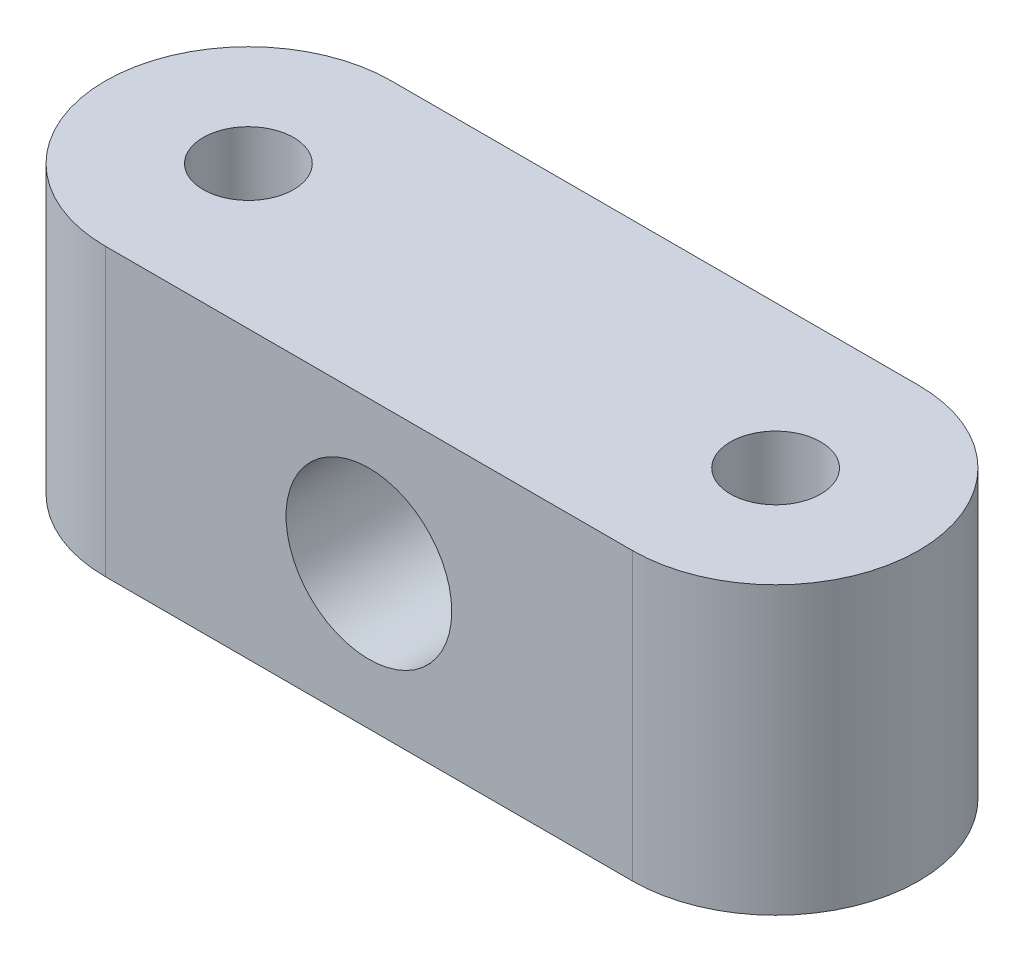
from build123d import *

# Parameters (mm, degrees)
SKETCH2_R                  = 6
BOSS_EXTRUDE1_DEPTH        = 38
M24X2_0_TAPPED_HOLE1_D     = 22
M24X2_0_TAPPED_HOLE1_DEPTH = 38
M24X2_0_TAPPED_HOLE1_TIP   = 6.609466809


with BuildPart() as part:
    # Sketch2 → Boss-Extrude1 (new body)
    with BuildSketch(Plane(origin=(0, 0, 0), x_dir=(1, 0, 0), z_dir=(0, 1, 0))):
        with BuildLine():
            Line((-35, 19), (35, 19))
            ThreePointArc((35, 19), (54, 0), (35, -19))
            Line((35, -19), (-35, -19))
            ThreePointArc((-35, -19), (-54, 0), (-35, 19))
        make_face()
        with Locations(Location((-35, 0, 0), (0, 0, 270))):
            Circle(SKETCH2_R, mode=Mode.SUBTRACT)
        with Locations(Location((35, 0, 0), (0, 0, 90))):
            Circle(SKETCH2_R, mode=Mode.SUBTRACT)
    extrude(amount=BOSS_EXTRUDE1_DEPTH)

    # M24x2.0 Tapped Hole1
    with Locations(Plane.XY.offset(19)):
        with Locations((0, 19)):
            Hole(M24X2_0_TAPPED_HOLE1_D / 2, depth=M24X2_0_TAPPED_HOLE1_DEPTH)
            with Locations((0, 0, -(M24X2_0_TAPPED_HOLE1_DEPTH + M24X2_0_TAPPED_HOLE1_TIP / 2))):  # 118° drill point
                Cone(0, M24X2_0_TAPPED_HOLE1_D / 2, M24X2_0_TAPPED_HOLE1_TIP, mode=Mode.SUBTRACT)


solid = part.part
